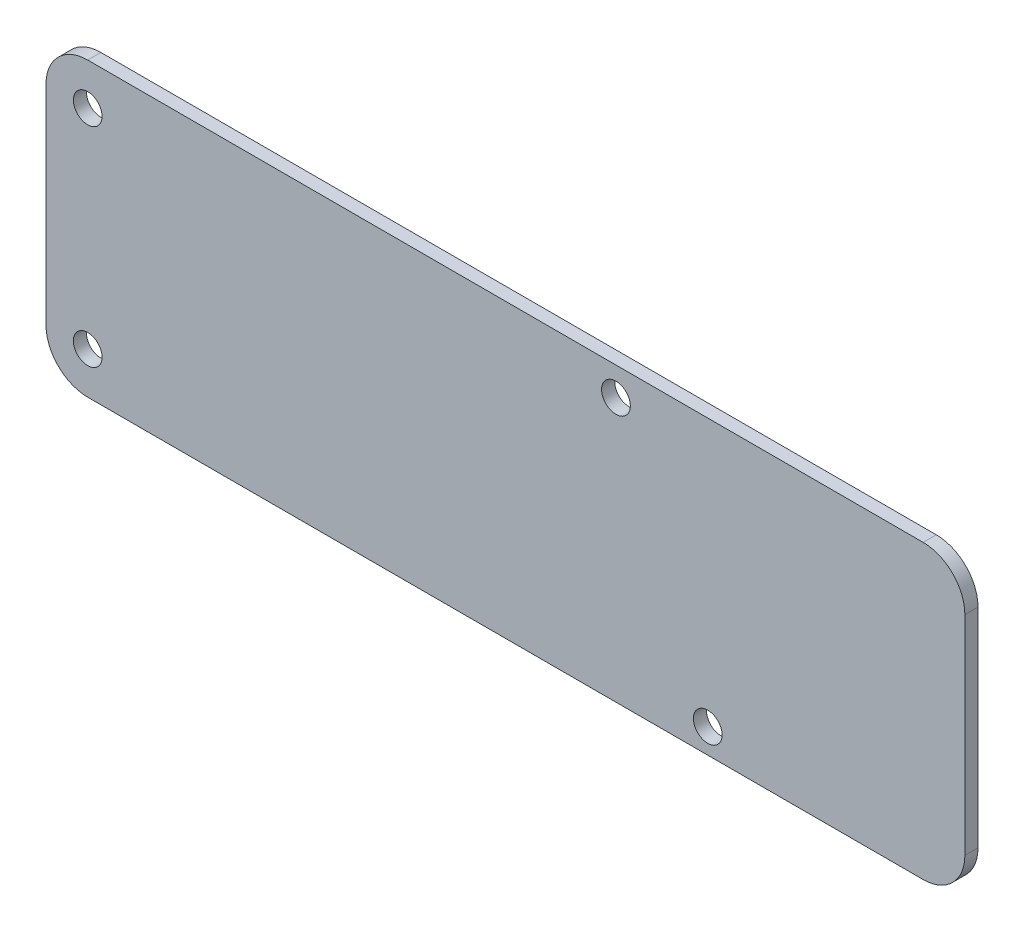
from build123d import *

# Parameters (mm, degrees)
SKETCH1_R           = 1.75
BOSS_EXTRUDE1_DEPTH = 1.6


with BuildPart() as part:
    # Sketch1 → Boss-Extrude1 (new body)
    with BuildSketch(Plane.XY):
        with BuildLine():
            Line((0, 5.08), (101.74, 5.08))
            ThreePointArc((101.74, 5.08), (105.332102448, 3.592102448), (106.82, 0))
            Line((106.82, 0), (106.82, -25.4))
            ThreePointArc((106.82, -25.4), (105.332102448, -28.992102448), (101.74, -30.48))
            Line((101.74, -30.48), (0, -30.48))
            ThreePointArc((0, -30.48), (-3.592102448, -28.992102448), (-5.08, -25.4))
            Line((-5.08, -25.4), (-5.08, 0))
            ThreePointArc((-5.08, 0), (-3.592102448, 3.592102448), (0, 5.08))
        make_face()
        Circle(SKETCH1_R, mode=Mode.SUBTRACT)
        with Locations((0, -25.4)):
            Circle(SKETCH1_R, mode=Mode.SUBTRACT)
        with Locations((64.33, 1.63)):
            Circle(SKETCH1_R, mode=Mode.SUBTRACT)
        with Locations((75.51, -27.48)):
            Circle(SKETCH1_R, mode=Mode.SUBTRACT)
    extrude(amount=BOSS_EXTRUDE1_DEPTH)


solid = part.part
